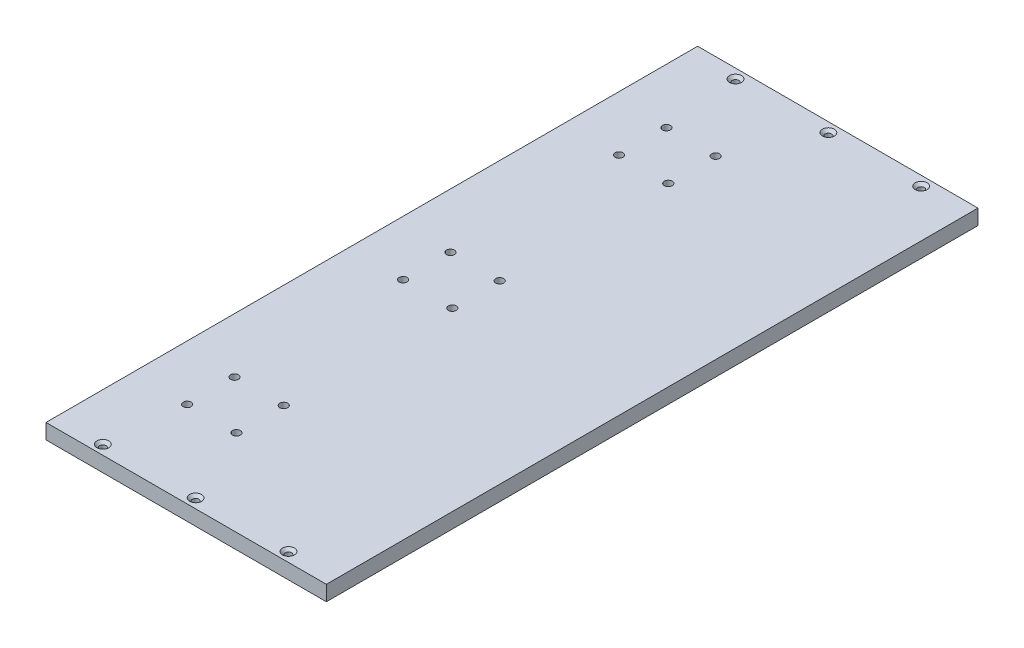
from build123d import *

# Parameters (mm, degrees)
SKETCH1_W                                    = 148
SKETCH1_H                                    = 344
BOSS_EXTRUDE1_DEPTH                          = 8
CSK_FOR_M3_COUNTERSUNK_FLAT_HEAD1_AT_2_COUNT = 2
CSK_FOR_M3_COUNTERSUNK_FLAT_HEAD1_AT_2_PITCH = 49
CSK_FOR_M3_COUNTERSUNK_FLAT_HEAD1_AT_3_COUNT = 2
CSK_FOR_M3_COUNTERSUNK_FLAT_HEAD1_AT_3_PITCH = 98
M5X0_8_TAPPED_HOLE1_D                        = 4.2
LPATTERN1_COUNT                              = 2
LPATTERN1_PITCH                              = 114
LPATTERN1_COL_COUNT                          = 2
LPATTERN1_COL_PITCH                          = 114


with BuildPart() as part:
    # Sketch1 → Boss-Extrude1 (new body)
    with BuildSketch(Plane(origin=(0, 0, 0), x_dir=(1, 0, 0), z_dir=(0, 1, 0))):
        Rectangle(SKETCH1_W, SKETCH1_H)
    extrude(amount=BOSS_EXTRUDE1_DEPTH)

    # Sketch3 → CSK for M3 Countersunk Flat Head1 (revolve, cut)
    with BuildSketch(Plane(origin=(-49, 8, 167), x_dir=(0, 0, 1), z_dir=(1, 0, 0))):
        Polygon((0, 0), (0, 16.021463052), (1.7, 15), (1.7, 1.45), (3.15, 0), align=None)
    csk_for_m3_countersunk_flat_head1 = revolve(axis=Axis((-49, 14.35, 167), (0, -1, 0)), mode=Mode.SUBTRACT)

    # CSK for M3 Countersunk Flat Head1 at 2: CSK for M3 Countersunk Flat Head1 ×2
    with Locations(*[(i * CSK_FOR_M3_COUNTERSUNK_FLAT_HEAD1_AT_2_PITCH, 0, 0) for i in range(1, CSK_FOR_M3_COUNTERSUNK_FLAT_HEAD1_AT_2_COUNT)]):
        add(csk_for_m3_countersunk_flat_head1, mode=Mode.SUBTRACT)

    # CSK for M3 Countersunk Flat Head1 at 3: CSK for M3 Countersunk Flat Head1 ×2
    with Locations(*[(i * CSK_FOR_M3_COUNTERSUNK_FLAT_HEAD1_AT_3_PITCH, 0, 0) for i in range(1, CSK_FOR_M3_COUNTERSUNK_FLAT_HEAD1_AT_3_COUNT)]):
        add(csk_for_m3_countersunk_flat_head1, mode=Mode.SUBTRACT)

    # Mirror1: CSK for M3 Countersunk Flat Head1 across plane
    add(csk_for_m3_countersunk_flat_head1.mirror(Plane.XY), mode=Mode.SUBTRACT)

    # Mirror1 copy 1 sketch → Mirror1 copy 1 (revolve, cut)
    with BuildSketch(Plane(origin=(0, 8, -167), x_dir=(0, 0, -1), z_dir=(1, 0, 0))):
        Polygon((0, 0), (0, -16.021463052), (1.7, -15), (1.7, -1.45), (3.15, 0), align=None)
    revolve(axis=Axis((0, 14.35, -167), (0, 1, 0)), mode=Mode.SUBTRACT)

    # Mirror1 copy 2 sketch → Mirror1 copy 2 (revolve, cut)
    with BuildSketch(Plane(origin=(49, 8, -167), x_dir=(0, 0, -1), z_dir=(1, 0, 0))):
        Polygon((0, 0), (0, -16.021463052), (1.7, -15), (1.7, -1.45), (3.15, 0), align=None)
    revolve(axis=Axis((49, 14.35, -167), (0, 1, 0)), mode=Mode.SUBTRACT)

    # M5x0.8 Tapped Hole1 (through all)
    with Locations(Plane(origin=(-19, 8, -12.5), x_dir=(0, 0, 1), z_dir=(0, 1, 0))):
        with Locations((0, 0), (0, -26), (25, -26), (25, 0)):
            m5x0_8_tapped_hole1 = Hole(M5X0_8_TAPPED_HOLE1_D / 2)

    # LPattern1: M5x0.8 Tapped Hole1 ×2
    with Locations(*[(0, 0, i * LPATTERN1_PITCH) for i in range(1, LPATTERN1_COUNT)]):
        add(m5x0_8_tapped_hole1, mode=Mode.SUBTRACT)

    # LPattern1 col: M5x0.8 Tapped Hole1 ×2
    with Locations(*[(0, 0, -i * LPATTERN1_COL_PITCH) for i in range(1, LPATTERN1_COL_COUNT)]):
        add(m5x0_8_tapped_hole1, mode=Mode.SUBTRACT)


solid = part.part
